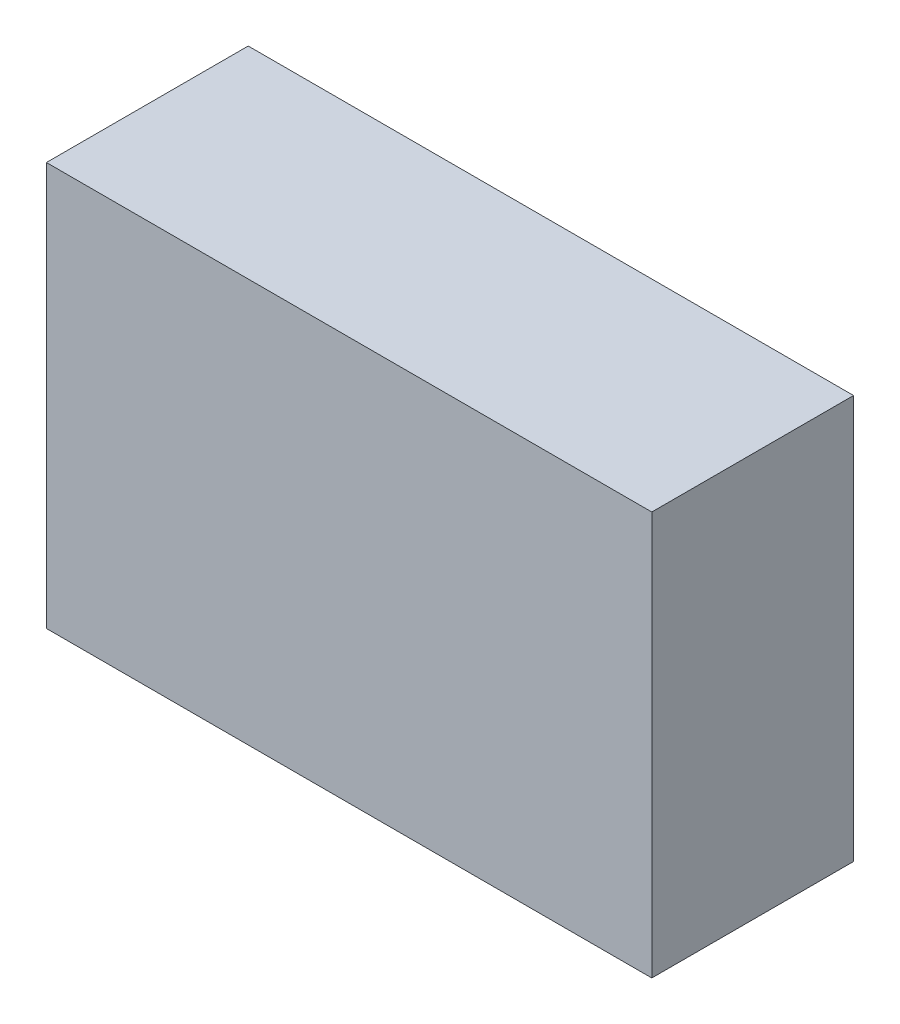
from build123d import *

# Parameters (mm, degrees)
SKETCH2_W           = 3
SKETCH2_H           = 2
BOSS_EXTRUDE1_DEPTH = 1


with BuildPart() as part:
    # Sketch2 → Boss-Extrude1 (new body)
    with BuildSketch(Plane.XY):
        with Locations((1.5, 1)):
            Rectangle(SKETCH2_W, SKETCH2_H)
    extrude(amount=BOSS_EXTRUDE1_DEPTH)


solid = part.part
